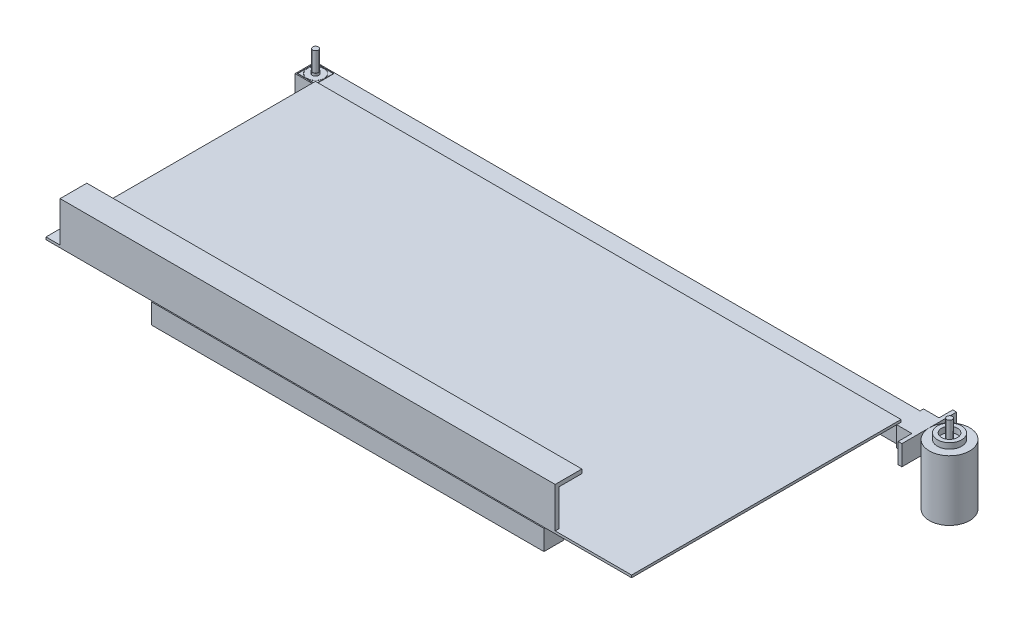
from build123d import *

# Parameters (mm, degrees)
SKETCH1_W                = 300
SKETCH1_H                = 310
BOSS_EXTRUDE1_DEPTH      = 25
SKETCH4_W                = 25.197370863
SKETCH4_H                = 44.858176632
BOSS_EXTRUDE2_DEPTH      = 25
SKETCH5_W                = 22.946033492
SKETCH5_H                = 22.760235649
CUT_EXTRUDE1_DEPTH       = 533.275174262
SKETCH7_W                = 22.191646781
SKETCH7_H                = 22.062999553
BOSS_EXTRUDE4_DEPTH      = 44
SKETCH8_R                = 10.655804952
CUT_EXTRUDE2_DEPTH       = 8
SKETCH9_R                = 10.638433537
CUT_EXTRUDE3_DEPTH       = 8
BOSS_EXTRUDE5_DEPTH      = 8
BOSS_EXTRUDE5_DEPTH_BACK = 36.858177
SKETCH12_R               = 10.458580424
SKETCH12_R_2             = 4
SKETCH14_W               = 727.477263183
SKETCH14_H               = 334.713139096
BOSS_EXTRUDE6_DEPTH      = 3
BOSS_EXTRUDE7_DEPTH      = 272
BOSS_EXTRUDE7_DEPTH_BACK = 343
BOSS_EXTRUDE8_DEPTH      = 3
BOSS_EXTRUDE8_DEPTH_BACK = 54
SKETCH16_R               = 3.92609933
SKETCH17_R               = 3.45
BOSS_EXTRUDE9_DEPTH      = 24
SKETCH18_R               = 25
BOSS_EXTRUDE10_DEPTH     = 75
BOSS_EXTRUDE12_DEPTH     = 25
SKETCH21_R               = 15
SKETCH21_R_2             = 10
BOSS_EXTRUDE13_DEPTH     = 7
SKETCH22_R               = 3.45
BOSS_EXTRUDE14_DEPTH     = 23


with BuildPart() as part:
    # Sketch1 → Boss-Extrude1 (new body)
    with BuildSketch(Plane(origin=(0, 0, 0), x_dir=(1, 0, 0), z_dir=(0, 1, 0))):
        Polygon((-360.507246377, 0), (389.492753623, 0), (389.492753623, -25), (189.492753623, -25), (189.492753623, -335), (258.333333333, -335), (258.333333333, -360), (-229.347826087, -360), (-229.347826087, -335), (-160.507246377, -335), (-160.507246377, -25), (-360.507246377, -25), align=None)
        with Locations((14.492753623, -180)):
            Rectangle(SKETCH1_W, SKETCH1_H, mode=Mode.SUBTRACT)
    extrude(amount=BOSS_EXTRUDE1_DEPTH)

    # Sketch4 → Boss-Extrude2 (add)
    with BuildSketch(Plane.ZY.offset(360.507246377)):
        with Locations((12.598685432, 2.570911684)):
            Rectangle(SKETCH4_W, SKETCH4_H)
    extrude(amount=BOSS_EXTRUDE2_DEPTH)

    # Sketch5 → Cut-Extrude1 (cut, through all)
    with BuildSketch(Plane(origin=(0, 25, 0), x_dir=(1, 0, 0), z_dir=(0, 1, 0))):
        with Locations((-372.836496425, -12.480540279)):
            Rectangle(SKETCH5_W, SKETCH5_H)
    extrude(amount=-CUT_EXTRUDE1_DEPTH, mode=Mode.SUBTRACT)

    # Sketch19 → Boss-Extrude12 (add)
    with BuildSketch(Plane(origin=(0, 25, 0), x_dir=(1, 0, 0), z_dir=(0, 1, 0))):
        Polygon((389.492753623, 0), (389.492753623, 21.483362749), (384.817785784, 21.483362749), (384.817785784, 4.33344442), (365.571766327, 4.33344442), (365.571766327, 0), align=None)
    boss_extrude12 = extrude(amount=-BOSS_EXTRUDE12_DEPTH)

    # Mirror1: Boss-Extrude12 across plane
    add(boss_extrude12.mirror(Plane.XY.offset(12.5)))


with BuildPart() as body_2:
    # Sketch7 → Boss-Extrude4 (new body)
    with BuildSketch(Plane(origin=(0, 25, 0), x_dir=(1, 0, 0), z_dir=(0, 1, 0))):
        with Locations((-372.849449875, -12.470537148)):
            Rectangle(SKETCH7_W, SKETCH7_H)
    extrude(amount=-BOSS_EXTRUDE4_DEPTH)

    # Sketch8 → Cut-Extrude2 (cut)
    with BuildSketch(Plane(origin=(0, 25, 0), x_dir=(1, 0, 0), z_dir=(0, 1, 0))):
        with Locations(Location((-372.836496425, -12.480540278, 0), (0, 0, 270))):
            Circle(SKETCH8_R)
    extrude(amount=-CUT_EXTRUDE2_DEPTH, mode=Mode.SUBTRACT)

    # Sketch9 → Cut-Extrude3 (cut)
    with BuildSketch(Plane(origin=(0, -19, 0), x_dir=(-1, 0, 0), z_dir=(0, -1, 0))):
        with Locations(Location((372.762225598, -12.486408958, 0), (0, 0, 90))):
            Circle(SKETCH9_R)
    extrude(amount=-CUT_EXTRUDE3_DEPTH, mode=Mode.SUBTRACT)

    # Sketch12 → Boss-Extrude5 (add, two sides: drawn at the far end of the back side and taken through both)
    with BuildSketch(Plane(origin=(0, 17, 0), x_dir=(1, 0, 0), z_dir=(0, 1, 0)).offset(-BOSS_EXTRUDE5_DEPTH_BACK)):
        with Locations(Location((-372.836496425, -12.480540278, 0), (0, 0, 90))):
            Circle(SKETCH12_R)
        with Locations(Location((-372.836496425, -12.480540278, 0), (0, 0, 90))):
            Circle(SKETCH12_R_2, mode=Mode.SUBTRACT)
    extrude(amount=BOSS_EXTRUDE5_DEPTH + BOSS_EXTRUDE5_DEPTH_BACK)

    # Sketch16 → Boss-Extrude8 (add, two sides: drawn at the far end of the back side and taken through both)
    with BuildSketch(Plane(origin=(0, 25, 0), x_dir=(1, 0, 0), z_dir=(0, 1, 0)).offset(-BOSS_EXTRUDE8_DEPTH_BACK)):
        with Locations(Location((-372.836496425, -12.480540278, 0), (0, 0, 270))):
            Circle(SKETCH16_R)
    extrude(amount=BOSS_EXTRUDE8_DEPTH + BOSS_EXTRUDE8_DEPTH_BACK)

    # Sketch17 → Boss-Extrude9 (add)
    with BuildSketch(Plane(origin=(0, 28, 0), x_dir=(1, 0, 0), z_dir=(0, 1, 0))):
        with Locations(Location((-372.836496425, -12.480540278, 0), (0, 0, 270))):
            Circle(SKETCH17_R)
    extrude(amount=BOSS_EXTRUDE9_DEPTH)


with BuildPart() as body_3:
    # Sketch14 → Boss-Extrude6 (new body)
    with BuildSketch(Plane(origin=(0, 26, 0), x_dir=(1, 0, 0), z_dir=(0, 1, 0))):
        with Locations((3.231385215, -192.356569548)):
            Rectangle(SKETCH14_W, SKETCH14_H)
    extrude(amount=BOSS_EXTRUDE6_DEPTH)

    # Sketch15 → Boss-Extrude7 (add, two sides: drawn at the far end of the back side and taken through both)
    with BuildSketch(Plane(origin=(0, 0, 0), x_dir=(0, 0, -1), z_dir=(1, 0, 0)).offset(-BOSS_EXTRUDE7_DEPTH_BACK)):
        Polygon((-359.713139096, 29), (-359.713139096, 79), (-326.500243697, 79), (-326.500243697, 74), (-354.713139096, 74), (-354.713139096, 29), align=None)
    extrude(amount=BOSS_EXTRUDE7_DEPTH + BOSS_EXTRUDE7_DEPTH_BACK)


with BuildPart() as body_4:
    # Sketch18 → Boss-Extrude10 (new body)
    with BuildSketch(Plane(origin=(0, 25, 0), x_dir=(1, 0, 0), z_dir=(0, 1, 0))):
        with Locations(Location((414.492753623, -12.246603976, 0), (0, 0, 270))):
            Circle(SKETCH18_R)
    extrude(amount=-BOSS_EXTRUDE10_DEPTH)

    # Sketch21 → Boss-Extrude13 (add)
    with BuildSketch(Plane(origin=(0, 25, 0), x_dir=(1, 0, 0), z_dir=(0, 1, 0))):
        with Locations(Location((414.492753623, -12.246603976, 0), (0, 0, 270))):
            Circle(SKETCH21_R)
        with Locations(Location((414.492753623, -12.246603976, 0), (0, 0, 270))):
            Circle(SKETCH21_R_2, mode=Mode.SUBTRACT)
    extrude(amount=BOSS_EXTRUDE13_DEPTH)

    # Sketch22 → Boss-Extrude14 (add)
    with BuildSketch(Plane(origin=(0, 25, 0), x_dir=(1, 0, 0), z_dir=(0, 1, 0))):
        with Locations(Location((414.492753623, -12.246603976, 0), (0, 0, 270))):
            Circle(SKETCH22_R)
    extrude(amount=BOSS_EXTRUDE14_DEPTH)


solid = Compound([part.part, body_2.part, body_3.part, body_4.part])
